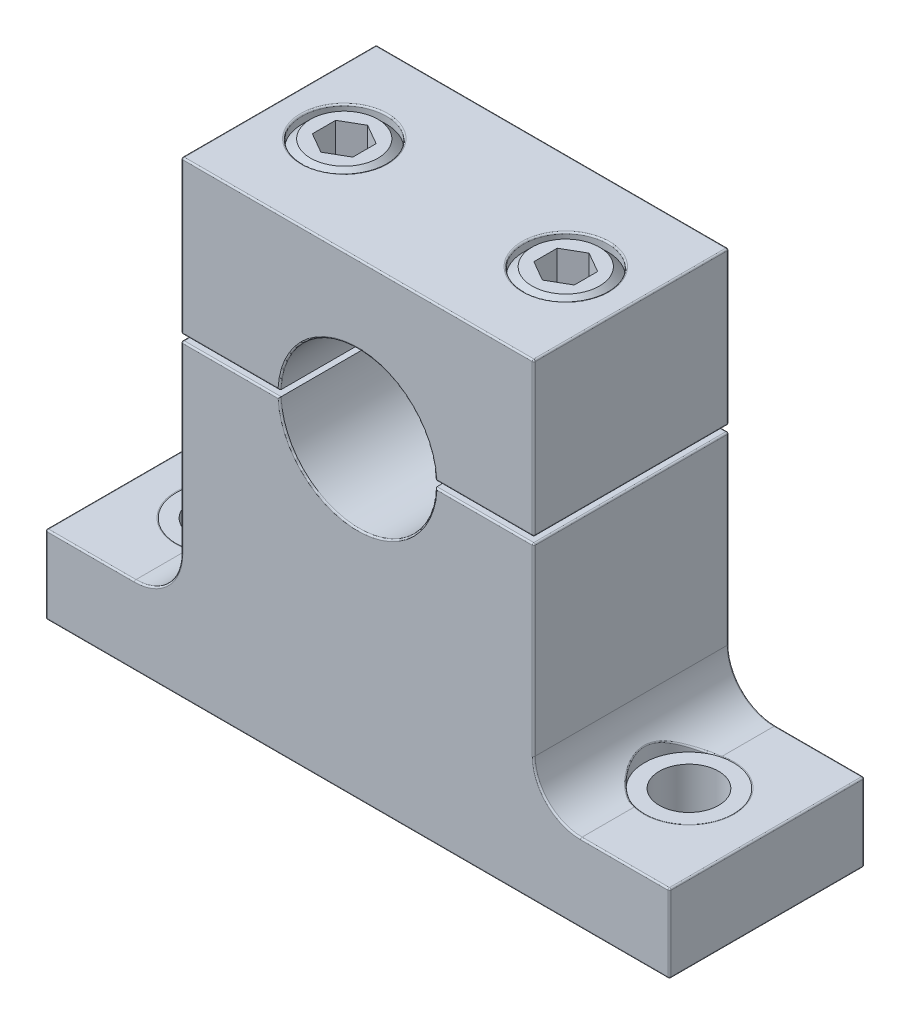
from build123d import *

# Parameters (mm, degrees)
BOSS_EXTRUDE1_DEPTH     = 7.9375
BOSS_EXTRUDE1_2_DEPTH   = 7.9375
SKETCH4_R               = 2.413
CUT_EXTRUDE1_DEPTH      = 42.427363013
CUT_EXTRUDE2_DEPTH      = 42.427363013
CUT_EXTRUDE2_DEPTH_BACK = 0.02
SKETCH5_R               = 3.6195
SKETCH6_R               = 3.429
CUT_EXTRUDE3_DEPTH      = 4.1656
SKETCH8_R               = 2.0828
CUT_EXTRUDE4_DEPTH      = 44.124325052
CUT_EXTRUDE5_DEPTH      = 3
CHAMFER1_SIZE           = 0.6858
FILLET1_R               = 0.127
FILLET2_R               = 0.127


with BuildPart() as part:
    # Sketch2 → Boss-Extrude1 (new, symmetric)
    with BuildSketch(Plane.XY):
        with BuildLine():
            Line((-14.351, 12.7), (14.351, 12.7))
            Line((14.351, 12.7), (14.351, 0.25))
            Line((14.351, 0.25), (6.345076832, 0.25))
            ThreePointArc((6.345076832, 0.25), (0, 6.35), (-6.345076832, 0.25))
            Line((-6.345076832, 0.25), (-14.351, 0.25))
            Line((-14.351, 0.25), (-14.351, 12.7))
        make_face()
    extrude(amount=BOSS_EXTRUDE1_DEPTH, both=True)

    # Sketch6 → Cut-Extrude3 (cut)
    with BuildSketch(Plane(origin=(0, 12.7, 0), x_dir=(1, 0, 0), z_dir=(0, 1, 0))):
        with Locations(Location((9.017, 0, 0), (0, 0, 180))):
            Circle(SKETCH6_R)
        with Locations(Location((-9.017, 0, 0), (0, 0, 180))):
            Circle(SKETCH6_R)
    extrude(amount=-CUT_EXTRUDE3_DEPTH, mode=Mode.SUBTRACT)


with BuildPart() as body_2:
    # Sketch2 → Boss-Extrude1 2 (new, symmetric)
    with BuildSketch(Plane.XY):
        with BuildLine():
            Line((25.4, -25.4), (-25.4, -25.4))
            Line((-25.4, -25.4), (-25.4, -19.05))
            Line((-25.4, -19.05), (-18.161, -19.05))
            ThreePointArc((-18.161, -19.05), (-15.466923164, -17.934076836), (-14.351, -15.24))
            Line((-14.351, -15.24), (-14.351, -0.25))
            Line((-14.351, -0.25), (-6.345076832, -0.25))
            ThreePointArc((-6.345076832, -0.25), (0, -6.35), (6.345076832, -0.25))
            Line((6.345076832, -0.25), (14.351, -0.25))
            Line((14.351, -0.25), (14.351, -15.24))
            ThreePointArc((14.351, -15.24), (15.466923164, -17.934076836), (18.161, -19.05))
            Line((18.161, -19.05), (25.4, -19.05))
            Line((25.4, -19.05), (25.4, -25.4))
        make_face()
    extrude(amount=BOSS_EXTRUDE1_2_DEPTH, both=True)

    # Sketch4 → Cut-Extrude1 (cut, through all)
    with BuildSketch(Plane(origin=(0, -19.05, 0), x_dir=(1, 0, 0), z_dir=(0, 1, 0))):
        with Locations(Location((-19.05, 0, 0), (0, 0, 180))):
            Circle(SKETCH4_R)
        with Locations(Location((19.05, 0, 0), (0, 0, 180))):
            Circle(SKETCH4_R)
    extrude(amount=-CUT_EXTRUDE1_DEPTH, mode=Mode.SUBTRACT)

    # Sketch5 → Cut-Extrude2 (cut, two sides: drawn at the far end of the back side and taken through both)
    with BuildSketch(Plane(origin=(0, -19.05, 0), x_dir=(1, 0, 0), z_dir=(0, 1, 0)).offset(-CUT_EXTRUDE2_DEPTH_BACK)):
        with Locations(Location((19.05, 0, 0), (0, 0, 104.218124187))):
            Circle(SKETCH5_R)
        with Locations(Location((-19.05, 0, 0), (0, 0, 75.781875813))):
            Circle(SKETCH5_R)
    extrude(amount=CUT_EXTRUDE2_DEPTH + CUT_EXTRUDE2_DEPTH_BACK, mode=Mode.SUBTRACT)


with BuildPart() as cut_extrude4_tool:
    # Sketch8 → Cut-Extrude4 (new, through all)
    with BuildSketch(Plane(origin=(0, 8.5344, 0), x_dir=(1, 0, 0), z_dir=(0, 1, 0))):
        with Locations(Location((9.017, 0, 0), (0, 0, 180))):
            Circle(SKETCH8_R)
        with Locations(Location((-9.017, 0, 0), (0, 0, 180))):
            Circle(SKETCH8_R)
    extrude(amount=-CUT_EXTRUDE4_DEPTH)


with BuildPart() as part_1:
    add(part.part)

    # Cut-Extrude4: cut by cut_extrude4_tool
    add(cut_extrude4_tool.part, mode=Mode.SUBTRACT)

    # Fillet2
    fillet2_edges = [part_1.edges().sort_by_distance(p)[0] for p in [
        (0, 6.35, 7.9375),
        (-14.351, 12.7, 0),
        (14.351, 12.7, 0),
        (14.351, 0.25, 0),
        (-14.351, 0.25, 0),
        (10.348038416, 0.25, 7.9375),
        (14.351, 6.475, 7.9375),
        (0, 12.7, 7.9375),
        (12.446, 12.7, 0),
        (-5.588, 12.7, 0),
        (-14.351, 6.475, 7.9375),
        (0, 12.7, -7.9375),
        (14.351, 6.475, -7.9375),
        (10.348038416, 0.25, -7.9375),
        (-10.348038416, 0.25, 7.9375),
        (0, 6.35, -7.9375),
        (-10.348038416, 0.25, -7.9375),
        (-14.351, 6.475, -7.9375),
    ]]
    fillet(fillet2_edges, radius=FILLET2_R)


with BuildPart() as body_2_1:
    add(body_2.part)

    # Cut-Extrude4: cut by cut_extrude4_tool
    add(cut_extrude4_tool.part, mode=Mode.SUBTRACT)

    # Fillet1
    fillet1_edges = [body_2_1.edges().sort_by_distance(p)[0] for p in [
        (15.4305, -17.897154446, 1e-09),
        (-15.4305, -17.897154446, -1e-09),
        (21.463, -25.4, 0),
        (-16.637, -25.4, 0),
        (-6.9342, -25.4, 0),
        (11.0998, -25.4, 0),
        (25.4, -25.4, 0),
        (25.4, -19.05, 0),
        (14.351, -0.25, 0),
        (-14.351, -0.25, 0),
        (-25.4, -19.05, 0),
        (-25.4, -25.4, 0),
        (21.7805, -19.05, -7.9375),
        (15.466923164, -17.934076836, -7.9375),
        (14.351, -7.745, -7.9375),
        (10.348038416, -0.25, -7.9375),
        (0, -6.35, -7.9375),
        (-10.348038416, -0.25, -7.9375),
        (-14.351, -7.745, -7.9375),
        (-15.466923164, -17.934076836, -7.9375),
        (-21.7805, -19.05, -7.9375),
        (-25.4, -22.225, -7.9375),
        (0, -25.4, -7.9375),
        (25.4, -22.225, -7.9375),
        (0, -25.4, 7.9375),
        (-25.4, -22.225, 7.9375),
        (-21.7805, -19.05, 7.9375),
        (-15.466923164, -17.934076836, 7.9375),
        (-14.351, -7.745, 7.9375),
        (-10.348038416, -0.25, 7.9375),
        (0, -6.35, 7.9375),
        (10.348038416, -0.25, 7.9375),
        (14.351, -7.745, 7.9375),
        (15.466923164, -17.934076836, 7.9375),
        (21.7805, -19.05, 7.9375),
        (25.4, -22.225, 7.9375),
    ]]
    fillet(fillet1_edges, radius=FILLET1_R)


with BuildPart() as body_3:
    # Sketch10 → Revolve1 (revolve)
    with BuildSketch(Plane.XY):
        Polygon((-9.017, 12.7), (-5.588, 12.7), (-5.588, 8.5344), (-6.9342, 8.5344), (-6.9342, -25.4), (-9.017, -25.4), align=None)
    revolve(axis=Axis((-9.017, -25.4, 0), (0, 1, 0)))

    # Sketch11 → Cut-Extrude5 (cut)
    with BuildSketch(Plane(origin=(0, 12.7, 0), x_dir=(1, 0, 0), z_dir=(0, 1, 0))):
        Polygon((-9.017, 1.90054471), (-10.66292, 0.950272355), (-10.66292, -0.950272355), (-9.017, -1.90054471), (-7.37108, -0.950272355), (-7.37108, 0.950272355), align=None)
    extrude(amount=-CUT_EXTRUDE5_DEPTH, mode=Mode.SUBTRACT)

    # Chamfer1
    chamfer1_edges = [body_3.edges().sort_by_distance(p)[0] for p in [
        (-12.446, 12.7, 0),
    ]]
    chamfer(chamfer1_edges, length=CHAMFER1_SIZE)


with BuildPart() as body_4:
    # Mirror1: mirrored copy
    add(body_3.part.mirror(Plane(origin=(0, 0, 0), x_dir=(0, 0, 1), z_dir=(1, 0, 0))))


solid = Compound([part_1.part, body_2_1.part, body_3.part, body_4.part])
